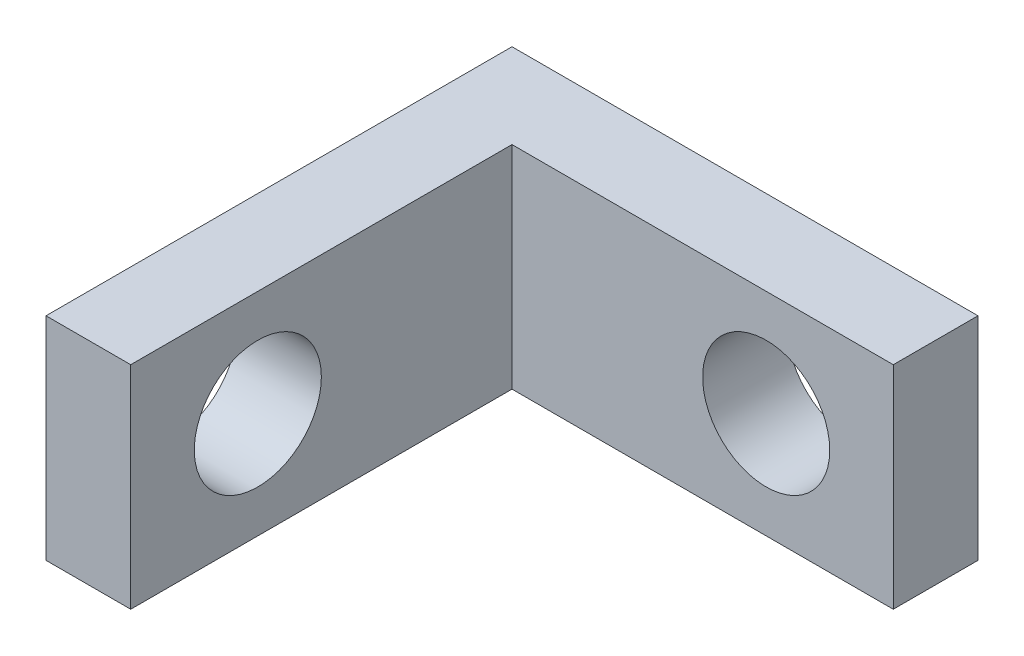
from build123d import *

# Parameters (mm, degrees)
SKETCH_1_R          = 1.5
EXTRUDE_1_DEPTH     = 2
SKETCH_2_W          = 2
SKETCH_2_H          = 5
EXTRUDE_2_DEPTH     = 9
SKETCH_3_R          = 1.5
CUT_EXTRUDE_1_DEPTH = 6


with BuildPart() as part:
    # 草图1 → 凸台-拉伸1 (new body)
    with BuildSketch(Plane(origin=(0, 0, 0), x_dir=(0, 0, -1), z_dir=(1, 0, 0))):
        Polygon((-11, 0), (-11, 2.5), (0, 2.5), (0, 0), (0, -2.5), (-11, -2.5), align=None)
        with Locations((-8, 0)):
            Circle(SKETCH_1_R, mode=Mode.SUBTRACT)
    extrude(amount=EXTRUDE_1_DEPTH)

    # 草图2 → 凸台-拉伸2 (add)
    with BuildSketch(Plane(origin=(2, 0, 0), x_dir=(0, 0, -1), z_dir=(1, 0, 0))):
        with Locations((-1, 0)):
            Rectangle(SKETCH_2_W, SKETCH_2_H)
    extrude(amount=EXTRUDE_2_DEPTH)

    # 草图3 → 切除-拉伸1 (cut)
    with BuildSketch(Plane.XY.offset(2)):
        with Locations((8, 0)):
            Circle(SKETCH_3_R)
    extrude(amount=-CUT_EXTRUDE_1_DEPTH, mode=Mode.SUBTRACT)


solid = part.part
